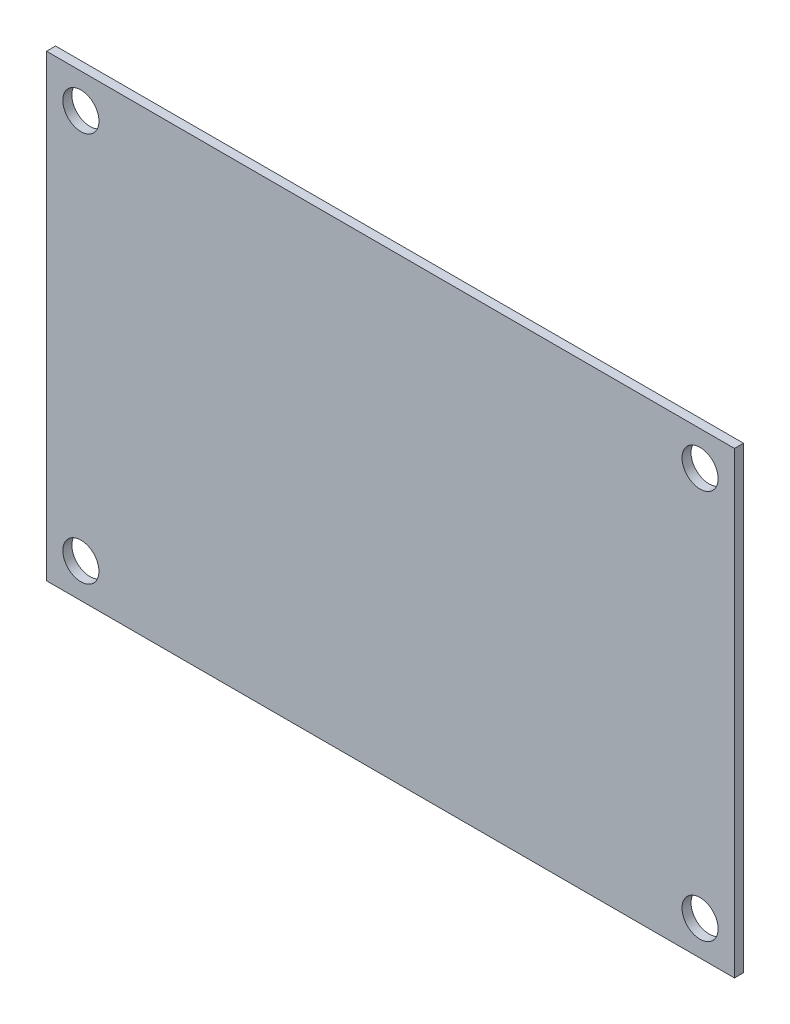
from build123d import *

# Parameters (mm, degrees)
SKETCH1_W           = 76.2
SKETCH1_H           = 50.8
SKETCH1_R           = 2
BOSS_EXTRUDE1_DEPTH = 1


with BuildPart() as part:
    # Sketch1 → Boss-Extrude1 (new body)
    with BuildSketch(Plane.XY):
        Rectangle(SKETCH1_W, SKETCH1_H)
        with Locations((-34.29, 21.59)):
            Circle(SKETCH1_R, mode=Mode.SUBTRACT)
        with Locations(Location((34.29, 21.59, 0), (0, 0, 180))):
            Circle(SKETCH1_R, mode=Mode.SUBTRACT)
        with Locations(Location((-34.29, -21.59, 0), (0, 0, 180))):
            Circle(SKETCH1_R, mode=Mode.SUBTRACT)
        with Locations((34.29, -21.59)):
            Circle(SKETCH1_R, mode=Mode.SUBTRACT)
    extrude(amount=BOSS_EXTRUDE1_DEPTH)


solid = part.part
